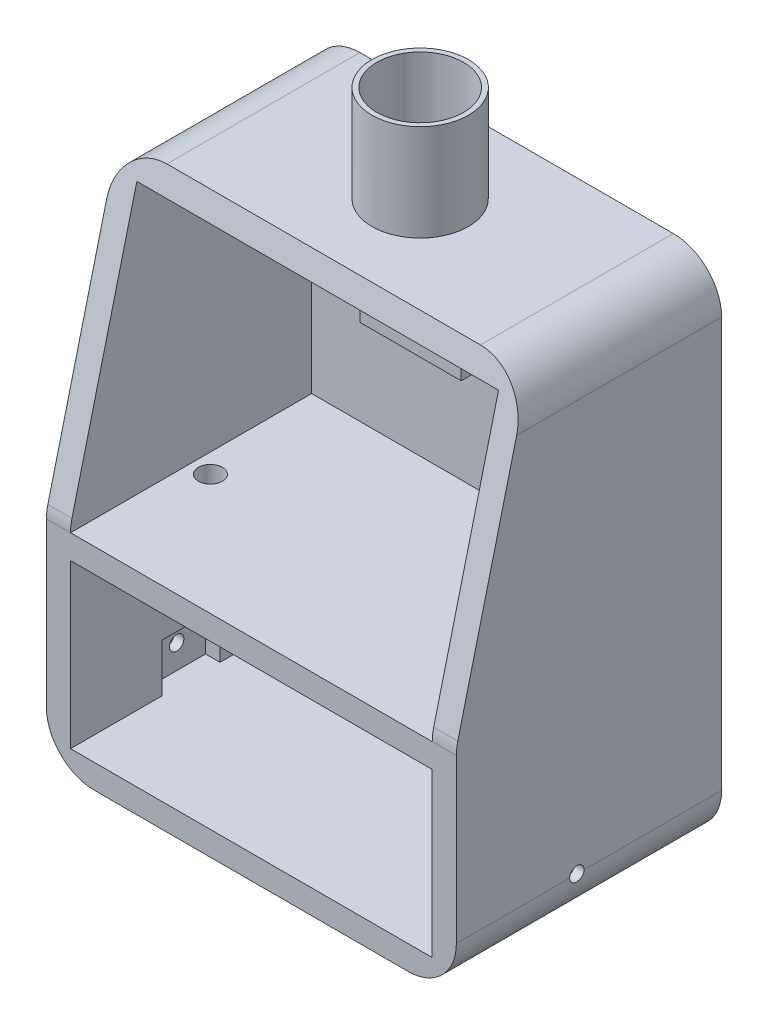
from build123d import *

# Parameters (mm, degrees)
SKETCH1_W               = 75
SKETCH1_H               = 95
BOSS_EXTRUDE4_DEPTH     = 50
BOSS_EXTRUDE5_START     = 5
BOSS_EXTRUDE5_DEPTH     = 5
CUT_EXTRUDE4_DEPTH      = 110.201648339
CUT_EXTRUDE4_DEPTH_BACK = 110.201648339
SKETCH7_R               = 1.5
SKETCH10_W              = 12
SKETCH10_H              = 10
CUT_EXTRUDE5_DEPTH      = 3
SKETCH11_W              = 12
SKETCH11_H              = 10
CUT_EXTRUDE6_DEPTH      = 3
CUT_EXTRUDE7_DEPTH      = 113.915898075
FILLET11_R              = 10
SKETCH13_W              = 50
SKETCH13_H              = 5
BOSS_EXTRUDE7_DEPTH     = 75
SKETCH17_R              = 1.5
CUT_EXTRUDE9_DEPTH      = 5
SKETCH18_W              = 21
SKETCH18_H              = 5
BOSS_EXTRUDE8_DEPTH     = 17
SKETCH21_R              = 2.5
CUT_EXTRUDE10_DEPTH     = 17
SKETCH22_R              = 10
SKETCH22_R_2            = 9
BOSS_EXTRUDE9_DEPTH     = 20
CUT_EXTRUDE11_START     = -5
SKETCH24_R              = 9
CUT_EXTRUDE11_DEPTH     = 5


with BuildPart() as part:
    # Sketch1 → Boss-Extrude4 (new body)
    with BuildSketch(Plane.XY):
        with BuildLine():
            Line((-35, -55), (30, -55))
            ThreePointArc((30, -55), (37.071067812, -52.071067812), (40, -45))
            Line((40, -45), (40, 40))
            ThreePointArc((40, 40), (37.071067812, 47.071067812), (30, 50))
            Line((30, 50), (-35, 50))
            ThreePointArc((-35, 50), (-42.071067812, 47.071067812), (-45, 40))
            Line((-45, 40), (-45, -45))
            ThreePointArc((-45, -45), (-42.071067812, -52.071067812), (-35, -55))
        make_face()
        with Locations((-2.5, -2.5)):
            Rectangle(SKETCH1_W, SKETCH1_H, mode=Mode.SUBTRACT)
    extrude(amount=BOSS_EXTRUDE4_DEPTH)

    # Sketch5 → Boss-Extrude5 (add)
    with BuildSketch(Plane(origin=(0, 0, 0), x_dir=(-1, 0, 0), z_dir=(0, 0, -1)).offset(BOSS_EXTRUDE5_START)):
        with BuildLine():
            Line((-30, -55), (35, -55))
            ThreePointArc((35, -55), (42.071067812, -52.071067812), (45, -45))
            Line((45, -45), (45, 40))
            ThreePointArc((45, 40), (42.071067812, 47.071067812), (35, 50))
            Line((35, 50), (-30, 50))
            ThreePointArc((-30, 50), (-37.071067812, 47.071067812), (-40, 40))
            Line((-40, 40), (-40, -45))
            ThreePointArc((-40, -45), (-37.071067812, -52.071067812), (-30, -55))
        make_face()
    extrude(amount=-BOSS_EXTRUDE5_DEPTH)

    # Sketch7 → Cut-Extrude4 (cut, two sides: drawn at the far end of the back side and taken through both)
    with BuildSketch(Plane.ZY.offset(-35).offset(-CUT_EXTRUDE4_DEPTH_BACK)):
        with Locations(Location((25, -45, 0), (0, 0, 180))):
            Circle(SKETCH7_R)
    extrude(amount=CUT_EXTRUDE4_DEPTH + CUT_EXTRUDE4_DEPTH_BACK, mode=Mode.SUBTRACT)

    # Sketch10 → Cut-Extrude5 (cut)
    with BuildSketch(Plane.ZY.offset(-35)):
        with Locations((25, -45)):
            Rectangle(SKETCH10_W, SKETCH10_H)
    extrude(amount=-CUT_EXTRUDE5_DEPTH, mode=Mode.SUBTRACT)

    # Sketch11 → Cut-Extrude6 (cut)
    with BuildSketch(Plane(origin=(-40, 0, 0), x_dir=(0, 0, -1), z_dir=(1, 0, 0))):
        with Locations((-25, -45)):
            Rectangle(SKETCH11_W, SKETCH11_H)
    extrude(amount=-CUT_EXTRUDE6_DEPTH, mode=Mode.SUBTRACT)

    # Sketch12 → Cut-Extrude7 (cut, through all)
    with BuildSketch(Plane(origin=(40, 0, 0), x_dir=(0, 0, -1), z_dir=(1, 0, 0))):
        Polygon((-50, -10), (-35, 50), (-50, 50), align=None)
    extrude(amount=-CUT_EXTRUDE7_DEPTH, mode=Mode.SUBTRACT)

    # Fillet11
    fillet11_edges = [part.edges().sort_by_distance(p)[0] for p in [
        (-42.5, -10, 50),
        (37.5, -10, 50),
    ]]
    fillet(fillet11_edges, radius=FILLET11_R)

    # Sketch13 → Boss-Extrude7 (add)
    with BuildSketch(Plane(origin=(-40, 0, 0), x_dir=(0, 0, -1), z_dir=(1, 0, 0))):
        with Locations((-25, -13.731056256)):
            Rectangle(SKETCH13_W, SKETCH13_H)
    extrude(amount=BOSS_EXTRUDE7_DEPTH)

    # Sketch17 → Cut-Extrude9 (cut)
    with BuildSketch(Plane.XY):
        with Locations((-2.5, -26.731056256)):
            Circle(SKETCH17_R)
    extrude(amount=-CUT_EXTRUDE9_DEPTH, mode=Mode.SUBTRACT)

    # Sketch18 → Boss-Extrude8 (add)
    with BuildSketch(Plane.XY):
        with Locations((-2.5, 26.060865593)):
            Rectangle(SKETCH18_W, SKETCH18_H)
    extrude(amount=BOSS_EXTRUDE8_DEPTH)

    # Sketch21 → Cut-Extrude10 (cut)
    with BuildSketch(Plane(origin=(0, -11.231056256, 0), x_dir=(1, 0, 0), z_dir=(0, 1, 0))):
        with Locations(Location((-36, -24.990851146, 0), (0, 0, 270))):
            Circle(SKETCH21_R)
        with Locations(Location((31, -24.990851146, 0), (0, 0, 270))):
            Circle(SKETCH21_R)
    extrude(amount=-CUT_EXTRUDE10_DEPTH, mode=Mode.SUBTRACT)

    # Sketch22 → Boss-Extrude9 (add)
    with BuildSketch(Plane(origin=(0, 50, 0), x_dir=(1, 0, 0), z_dir=(0, 1, 0))):
        with Locations(Location((-2.5, -15, 0), (0, 0, 90))):
            Circle(SKETCH22_R)
        with Locations(Location((-2.5, -15, 0), (0, 0, 270))):
            Circle(SKETCH22_R_2, mode=Mode.SUBTRACT)
    extrude(amount=BOSS_EXTRUDE9_DEPTH)

    # Sketch24 → Cut-Extrude11 (cut)
    with BuildSketch(Plane(origin=(0, 50, 0), x_dir=(1, 0, 0), z_dir=(0, 1, 0)).offset(CUT_EXTRUDE11_START)):
        with Locations(Location((-2.5, -15, 0), (0, 0, 270))):
            Circle(SKETCH24_R)
    extrude(amount=CUT_EXTRUDE11_DEPTH, mode=Mode.SUBTRACT)


solid = part.part
